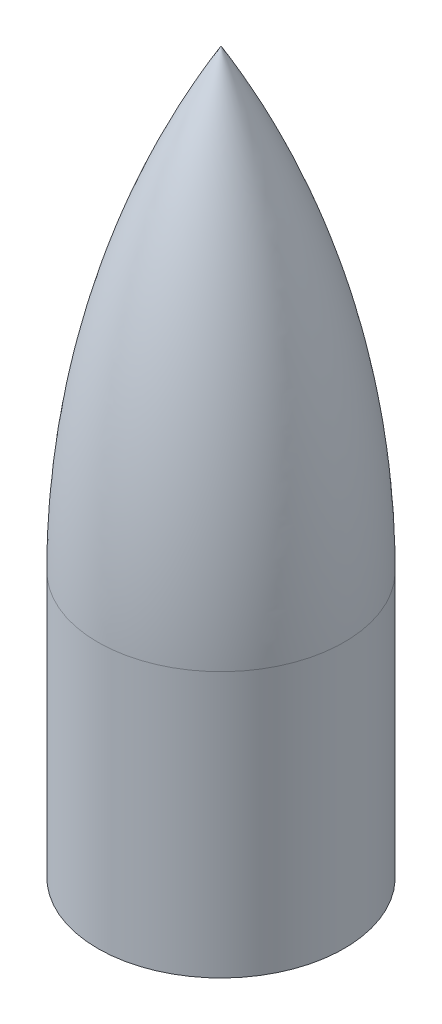
from build123d import *


with BuildPart() as part:
    # Esquisse1 → Révolution1 (revolve)
    with BuildSketch(Plane.XY, mode=Mode.PRIVATE) as r_volution1_sk:
        with BuildLine():
            Line((0, 0), (-3.25, 0))
            Line((-3.25, 0), (-3.25, 7))
            ThreePointArc((-3.25, 7), (-2.423123248, 13.21615838), (0, 19))
            Line((0, 19), (0, 0))
        make_face()
    revolve(r_volution1_sk.sketch.rotate(Axis((0, 0, 0), (0, 1, 0)), 270), axis=Axis((0, 0, 0), (0, 1, 0)))


solid = part.part
